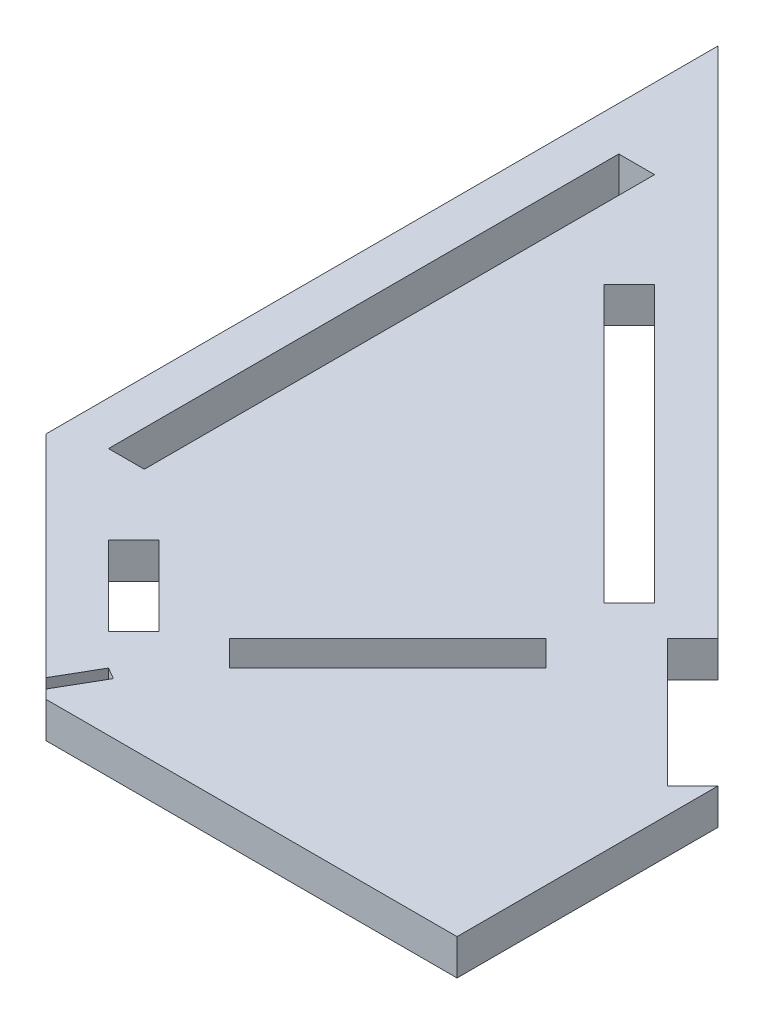
from build123d import *

# Parameters (mm, degrees)
SKETCH1_W           = 8
SKETCH1_H           = 113.93
BOSS_EXTRUDE1_DEPTH = 8


with BuildPart() as part:
    # Sketch1 → Boss-Extrude1 (new body)
    with BuildSketch(Plane(origin=(0, 0, 0), x_dir=(1, 0, 0), z_dir=(0, 1, 0))):
        Polygon((-91.75, 0), (0, 0), (0, 58.25), (-0.001499297, 58.251499297), (-5.658353547, 52.594645048), (-34.126472557, 81.062764058), (-28.469618308, 86.719618308), (-143.078881246, 201.328881246), (-143.078881246, 51.328881246), (-95.946152423, 4.196152423), (-90.846474596, 13.02905352), (-88.248398385, 11.52905352), (-93.75, 2), align=None)
        Polygon((-97.917542408, 20.100121332), (-115.595211938, 37.777790862), (-109.938357688, 43.434645111), (-92.260688159, 25.756975582), align=None, mode=Mode.SUBTRACT)
        Polygon((-77.337199542, 26.538328575), (-82.994053791, 32.195182824), (-47.638714732, 67.550521884), (-41.981860482, 61.893667634), align=None, mode=Mode.SUBTRACT)
        with Locations((-129.272881467, 112.420460392)):
            Rectangle(SKETCH1_W, SKETCH1_H, mode=Mode.SUBTRACT)
        Polygon((-48.085105233, 80.883975658), (-109.716532281, 142.515402707), (-104.059678032, 148.172256956), (-42.428250984, 86.540829908), align=None, mode=Mode.SUBTRACT)
    extrude(amount=BOSS_EXTRUDE1_DEPTH)


solid = part.part
